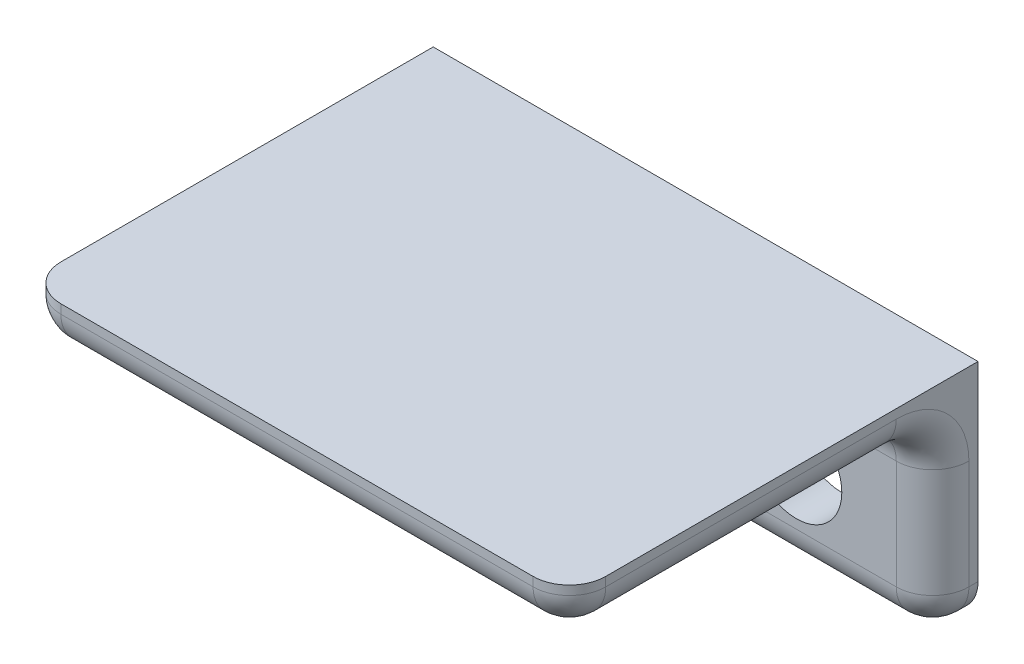
from build123d import *

# Parameters (mm, degrees)
SKETCH1_W           = 30
SKETCH1_H           = 10
SKETCH1_R           = 2.5
BOSS_EXTRUDE1_DEPTH = 2.5
SKETCH2_W           = 30
SKETCH2_H           = 2.5
BOSS_EXTRUDE2_DEPTH = 22.5
FILLET1_R           = 2


with BuildPart() as part:
    # Sketch1 → Boss-Extrude1 (new body)
    with BuildSketch(Plane(origin=(0, 0, 0), x_dir=(-1, 0, 0), z_dir=(0, 0, 1))):
        with Locations((-41.638953423, 46.1)):
            Rectangle(SKETCH1_W, SKETCH1_H)
        with Locations(Location((-49.138953423, 46.1, 0), (0, 0, 180))):
            Circle(SKETCH1_R, mode=Mode.SUBTRACT)
        with Locations((-34.138953423, 46.1)):
            Circle(SKETCH1_R, mode=Mode.SUBTRACT)
    extrude(amount=BOSS_EXTRUDE1_DEPTH)

    # Sketch2 → Boss-Extrude2 (add)
    with BuildSketch(Plane(origin=(0, 0, 0), x_dir=(-1, 0, 0), z_dir=(0, 0, -1))):
        with Locations((-41.638953423, -39.85)):
            Rectangle(SKETCH2_W, SKETCH2_H)
    extrude(amount=-BOSS_EXTRUDE2_DEPTH)

    # Fillet1
    fillet1_edges = [part.edges().sort_by_distance(p)[0] for p in [
        (26.638953423, -46.1, 2.5),
        (41.638953423, -51.1, 2.5),
        (41.638953423, -41.1, 22.5),
        (26.638953423, -41.1, 12.5),
        (26.638953423, -39.85, 22.5),
        (56.638953423, -39.85, 22.5),
        (56.638953423, -41.1, 12.5),
        (56.638953423, -46.1, 2.5),
        (56.638953423, -51.1, 1.25),
        (26.638953423, -51.1, 1.25),
        (41.638953423, -41.1, 2.5),
    ]]
    fillet(fillet1_edges, radius=FILLET1_R)


solid = part.part
